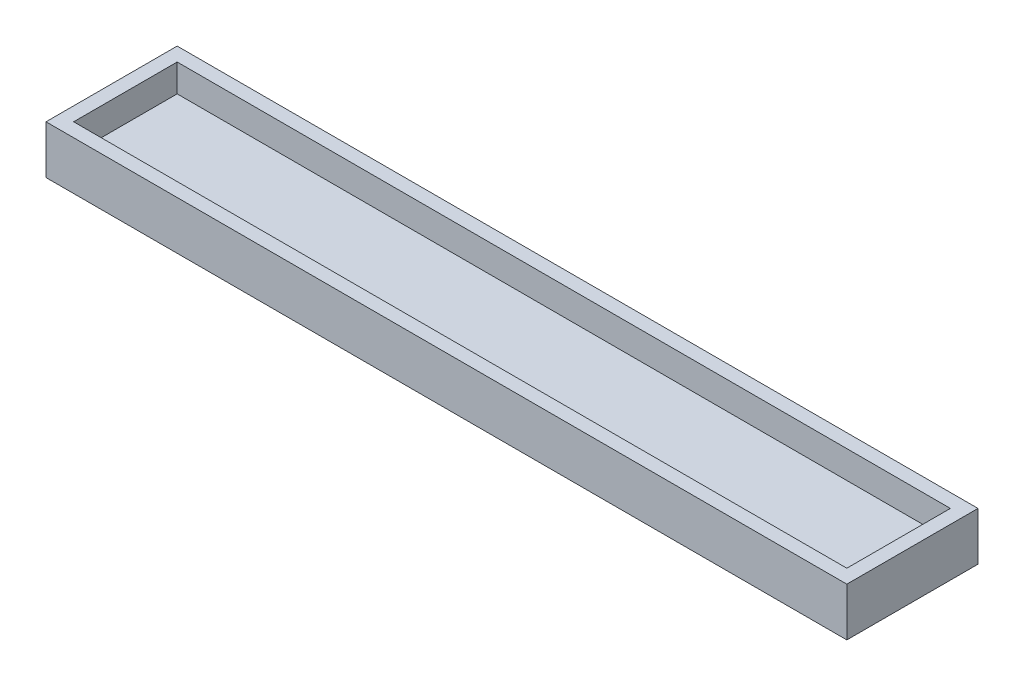
from build123d import *

# Parameters (mm, degrees)
SKETCH1_W         = 112
SKETCH1_H         = 15
BOTTOM_DEPTH      = 3
SKETCH1_3_W       = 116
SKETCH1_3_H       = 19
SKETCH1_3_W_2     = 112
SKETCH1_3_H_2     = 15
RAISED_EDGE_DEPTH = 7


with BuildPart() as part:
    # Sketch1 → bottom (new body)
    with BuildSketch(Plane(origin=(0, 0, 0), x_dir=(1, 0, 0), z_dir=(0, 1, 0))):
        with Locations((56, 7.5)):
            Rectangle(SKETCH1_W, SKETCH1_H)
    extrude(amount=BOTTOM_DEPTH)

    # Sketch1<3> → raised edge (add)
    with BuildSketch(Plane(origin=(0, 0, 0), x_dir=(1, 0, 0), z_dir=(0, 1, 0))):
        with Locations((56, 7.5)):
            Rectangle(SKETCH1_3_W, SKETCH1_3_H)
        with Locations((56, 7.5)):
            Rectangle(SKETCH1_3_W_2, SKETCH1_3_H_2, mode=Mode.SUBTRACT)
    extrude(amount=RAISED_EDGE_DEPTH)


solid = part.part
